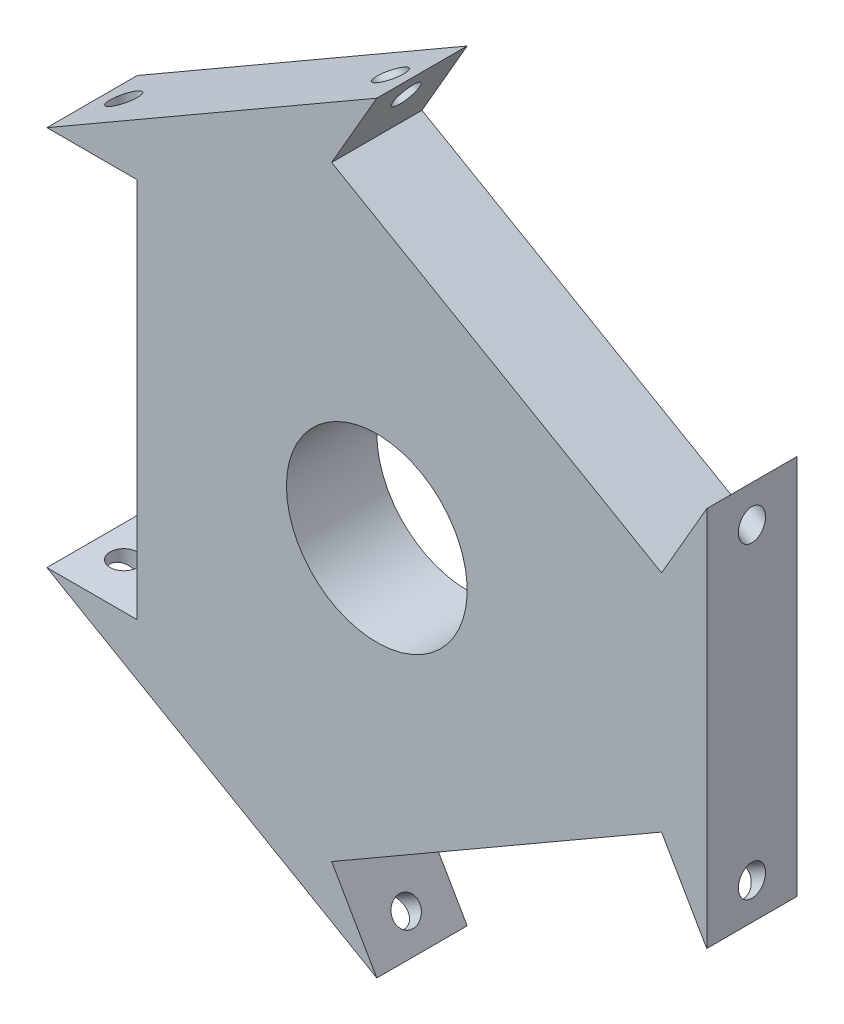
from build123d import *

# Parameters (mm, degrees)
BOSS_EXTRUDE1_DEPTH = 10
SKETCH3_R           = 1.5
CUT_EXTRUDE1_DEPTH  = 74.703487344
SKETCH5_R           = 10
CUT_EXTRUDE2_DEPTH  = 10
CIRPATTERN1_COUNT   = 3


with BuildPart() as part:
    # Sketch1 → Boss-Extrude1 (new body)
    with BuildSketch(Plane.XY):
        Polygon((-36.510971114, 21.079619001), (-26.510971114, 21.079619001), (-26.510971114, -21.079619001), (-36.510971114, -21.079619001), (0, -42.159238002), (-5, -33.498983964), (31.510971114, -12.419364963), (36.510971114, -21.079619001), (36.510971114, 21.079619001), (31.510971114, 12.419364963), (-5, 33.498983964), (0, 42.159238002), align=None)
    extrude(amount=BOSS_EXTRUDE1_DEPTH)

    # Sketch3 → Cut-Extrude1 (cut, symmetric)
    with BuildSketch(Plane(origin=(0, -21.079619001, 0), x_dir=(1, 0, 0), z_dir=(0, 1, 0))):
        with Locations(Location((-33.010971114, -5, 0), (0, 0, 90))):
            Circle(SKETCH3_R)
    cut_extrude1 = extrude(amount=CUT_EXTRUDE1_DEPTH, both=True, mode=Mode.SUBTRACT)

    # Sketch5 → Cut-Extrude2 (cut)
    with BuildSketch(Plane(origin=(0, 0, 0), x_dir=(-1, 0, 0), z_dir=(0, 0, -1))):
        Circle(SKETCH5_R)
    extrude(amount=-CUT_EXTRUDE2_DEPTH, mode=Mode.SUBTRACT)

    # CirPattern1: Cut-Extrude1 ×3 about axis
    cirpattern1_axis = Axis((0, 0, 10), (0, 0, -1))
    for i in range(1, CIRPATTERN1_COUNT):
        add(cut_extrude1.rotate(cirpattern1_axis, i * 360 / CIRPATTERN1_COUNT), mode=Mode.SUBTRACT)


solid = part.part
